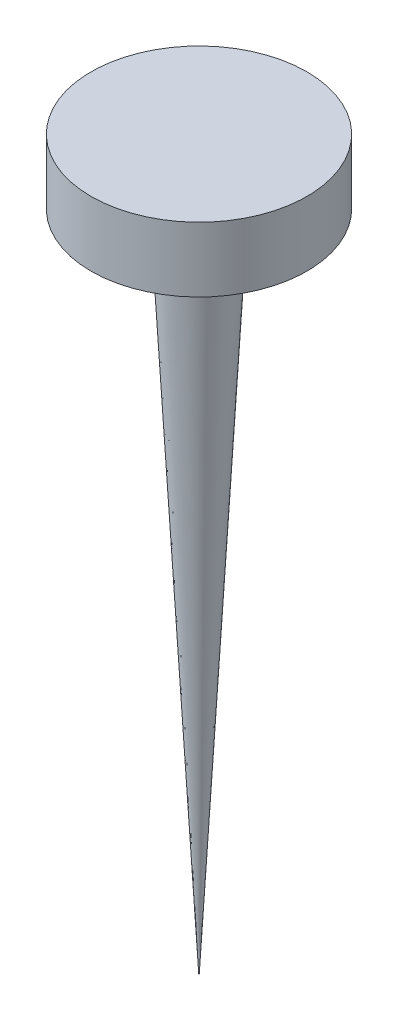
from build123d import *


with BuildPart() as part:
    # Sketch1 → Revolve2 (revolve)
    with BuildSketch(Plane.XY, mode=Mode.PRIVATE) as revolve2_sk:
        Polygon((-0.5, -0.3), (-0.5, 0), (0, 0), (0, -3.385), (-0.161677999, -0.3), align=None)
    revolve(revolve2_sk.sketch.rotate(Axis((0, 0, 0), (0, -1, 0)), 270), axis=Axis((0, 0, 0), (0, -1, 0)))


solid = part.part
